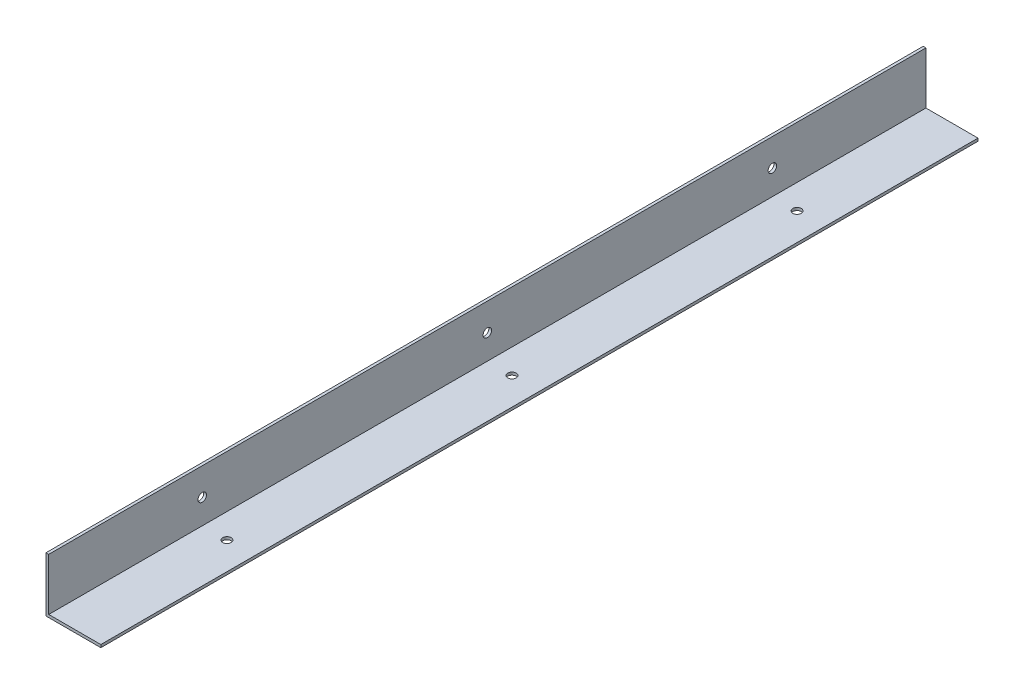
from build123d import *

# Parameters (mm, degrees)
BOSS_EXTRUDE1_DEPTH          = 508
F_10_0_1935_DIAMETER_HOLE2_D = 4.9149
F_10_0_1935_DIAMETER_HOLE4_D = 4.9149


with BuildPart() as part:
    # Sketch2 → Boss-Extrude1 (new body)
    with BuildSketch(Plane.XY):
        Polygon((0, 0), (0, 31.75), (1.5875, 31.75), (1.5875, 1.5875), (31.75, 1.5875), (31.75, 0), align=None)
    extrude(amount=BOSS_EXTRUDE1_DEPTH)

    # #10 (0.1935) Diameter Hole2 (through all)
    with Locations(Plane.ZY):
        with Locations((419.1, 15.875), (88.9, 15.875), (254, 15.875)):
            Hole(F_10_0_1935_DIAMETER_HOLE2_D / 2)

    # #10 (0.1935) Diameter Hole4 (through all)
    with Locations(Plane(origin=(0, 0, 0), x_dir=(-1, 0, 0), z_dir=(0, -1, 0))):
        with Locations((-15.875, -419.1), (-15.875, -254), (-15.875, -88.9)):
            Hole(F_10_0_1935_DIAMETER_HOLE4_D / 2)


solid = part.part
